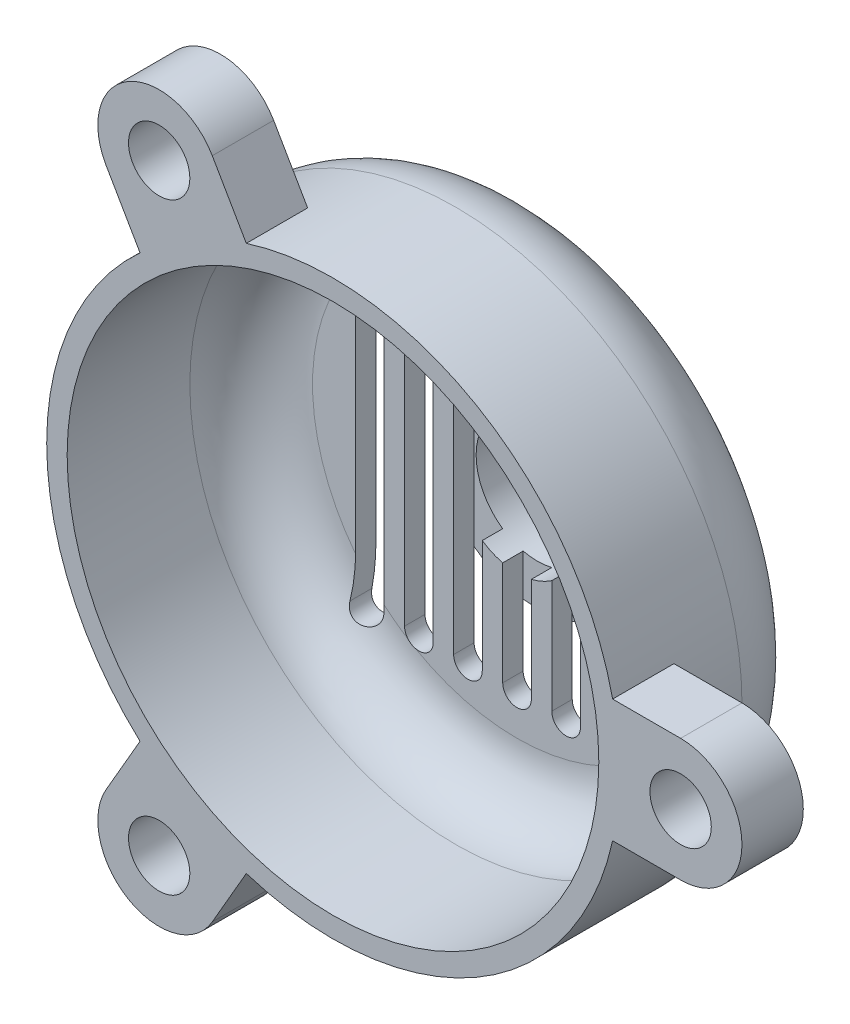
from build123d import *

# Parameters (mm, degrees)
SKETCH1_R               = 3.5
BOSS_EXTRUDE1_DEPTH     = 1.25
FILLET1_R               = 1
SHELL1_T                = -0.25
CUT_EXTRUDE1_DEPTH      = 6.545268253
LPATTERN1_COUNT         = 4
LPATTERN1_PITCH         = 0.6
LPATTERN2_COUNT         = 4
LPATTERN2_PITCH         = 0.6
SKETCH3_R               = 1.25
BOSS_EXTRUDE2_DEPTH     = 0.75
CUT_EXTRUDE2_DEPTH      = 6.545268379
CUT_EXTRUDE2_DEPTH_BACK = 6.545268379
SKETCH3_3_R             = 0.75
SKETCH4_R               = 0.375
BOSS_EXTRUDE3_DEPTH     = 0.75
CIRPATTERN1_COUNT       = 3


with BuildPart() as part:
    # Sketch1 → Boss-Extrude1 (new, symmetric)
    with BuildSketch(Plane.XY):
        Circle(SKETCH1_R)
    extrude(amount=BOSS_EXTRUDE1_DEPTH, both=True)

    # Fillet1
    fillet1_edges = [part.edges().sort_by_distance(p)[0] for p in [
        (-3.5, 0, -1.25),
    ]]
    fillet(fillet1_edges, radius=FILLET1_R)

    # Shell1
    shell1_openings = [part.faces().sort_by_distance(p)[0] for p in [
        (0, 0, 1.25),
    ]]
    offset(amount=SHELL1_T, openings=shell1_openings, kind=Kind.INTERSECTION)

    # Sketch2 → Cut-Extrude1 (cut, through all)
    with BuildSketch(Plane(origin=(0, 0, -1.25), x_dir=(-1, 0, 0), z_dir=(0, 0, -1))):
        with BuildLine():
            Line((0.175, 2), (0.175, -2))
            ThreePointArc((0.175, -2), (0, -2.175), (-0.175, -2))
            Line((-0.175, -2), (-0.175, 2))
            ThreePointArc((-0.175, 2), (0, 2.175), (0.175, 2))
        make_face()
    cut_extrude1 = extrude(amount=-CUT_EXTRUDE1_DEPTH, mode=Mode.SUBTRACT)

    # LPattern1: Cut-Extrude1 ×4
    with Locations(*[(i * LPATTERN1_PITCH, 0, 0) for i in range(1, LPATTERN1_COUNT)]):
        add(cut_extrude1, mode=Mode.SUBTRACT)

    # LPattern2: Cut-Extrude1 ×4
    with Locations(*[(-i * LPATTERN2_PITCH, 0, 0) for i in range(1, LPATTERN2_COUNT)]):
        add(cut_extrude1, mode=Mode.SUBTRACT)

    # Sketch3 → Boss-Extrude2 (add)
    with BuildSketch(Plane(origin=(0, 0, -1.25), x_dir=(-1, 0, 0), z_dir=(0, 0, -1))):
        Circle(SKETCH3_R)
    extrude(amount=BOSS_EXTRUDE2_DEPTH)

    # Sketch3<3> → Cut-Extrude2 (cut, two sides: drawn at the far end of the back side and taken through both)
    with BuildSketch(Plane(origin=(0, 0, -1.25), x_dir=(-1, 0, 0), z_dir=(0, 0, -1)).offset(-CUT_EXTRUDE2_DEPTH_BACK)):
        Circle(SKETCH3_3_R)
    extrude(amount=CUT_EXTRUDE2_DEPTH + CUT_EXTRUDE2_DEPTH_BACK, mode=Mode.SUBTRACT)

    # Sketch4 → Boss-Extrude3 (add)
    with BuildSketch(Plane.XY.offset(1.25)):
        with BuildLine():
            Line((4.25, 0.75), (3.418698583, 0.75))
            ThreePointArc((3.418698583, 0.75), (3.5, 0), (3.418698583, -0.75))
            Line((3.418698583, -0.75), (4.25, -0.75))
            ThreePointArc((4.25, -0.75), (5, 0), (4.25, 0.75))
        make_face()
        with Locations((4.25, 0)):
            Circle(SKETCH4_R, mode=Mode.SUBTRACT)
    boss_extrude3 = extrude(amount=-BOSS_EXTRUDE3_DEPTH)

    # CirPattern1: Boss-Extrude3 ×3 about axis
    cirpattern1_axis = Axis((0, 0, 1.25), (0, 0, 1))
    for i in range(1, CIRPATTERN1_COUNT):
        add(boss_extrude3.rotate(cirpattern1_axis, i * 360 / CIRPATTERN1_COUNT))


solid = part.part
